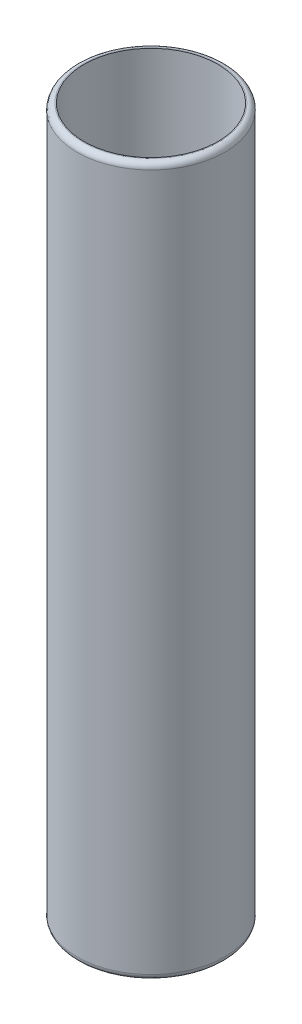
from build123d import *

# Parameters (mm, degrees)
SKETCH1_R           = 15.875
SKETCH1_R_2         = 14.4018
BOSS_EXTRUDE1_DEPTH = 152.4
FILLET1_R           = 1.27


with BuildPart() as part:
    # Sketch1 → Boss-Extrude1 (new body)
    with BuildSketch(Plane(origin=(0, 0, 0), x_dir=(1, 0, 0), z_dir=(0, 1, 0))):
        with Locations(Location((0, 0, 0), (0, 0, 90))):
            Circle(SKETCH1_R)
        with Locations(Location((0, 0, 0), (0, 0, 90))):
            Circle(SKETCH1_R_2, mode=Mode.SUBTRACT)
    extrude(amount=BOSS_EXTRUDE1_DEPTH)

    # Fillet1
    fillet1_edges = [part.edges().sort_by_distance(p)[0] for p in [
        (0, 0, 15.875),
        (0, 152.4, 15.875),
    ]]
    fillet(fillet1_edges, radius=FILLET1_R)


solid = part.part
